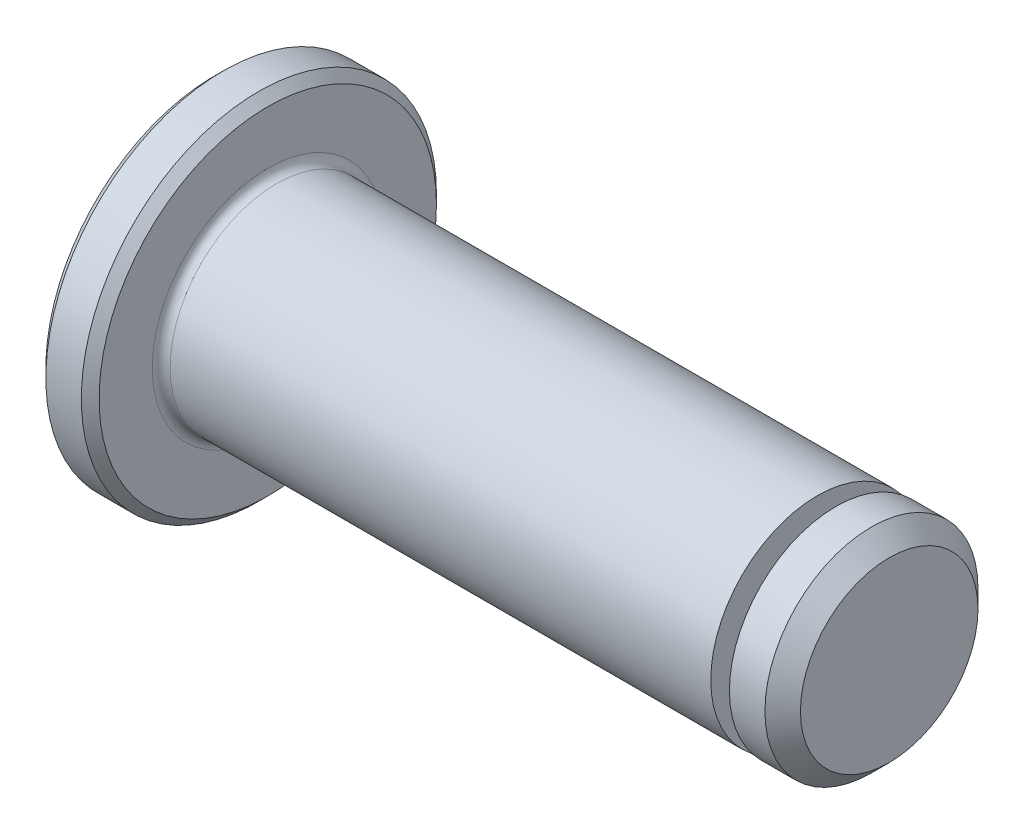
from build123d import *

# Parameters (mm, degrees)
SCHIZZO1_R                   = 10
ESTRUSIONE_ESTRUSIONE1_DEPTH = 3
SCHIZZO2_R                   = 6
ESTRUSIONE_ESTRUSIONE2_DEPTH = 35
SCHIZZO3_W                   = 1.05
SCHIZZO3_H                   = 2
SMUSSO1_SIZE                 = 1
SMUSSO2_SIZE                 = 0.5
RACCORDO1_R                  = 0.5


with BuildPart() as part:
    # Schizzo1 → Estrusione-Estrusione1 (new body)
    with BuildSketch(Plane(origin=(0, 0, 0), x_dir=(0, 0, -1), z_dir=(1, 0, 0))):
        Circle(SCHIZZO1_R)
    extrude(amount=ESTRUSIONE_ESTRUSIONE1_DEPTH)

    # Schizzo2 → Estrusione-Estrusione2 (add)
    with BuildSketch(Plane(origin=(3, 0, 0), x_dir=(0, 0, -1), z_dir=(1, 0, 0))):
        Circle(SCHIZZO2_R)
    extrude(amount=ESTRUSIONE_ESTRUSIONE2_DEPTH)

    # Schizzo3 → Taglia-Rivoluzione1 (revolve, cut)
    with BuildSketch(Plane.XY, mode=Mode.PRIVATE) as taglia_rivoluzione1_sk:
        with Locations((34.475, 5)):
            Rectangle(SCHIZZO3_W, SCHIZZO3_H)
    revolve(taglia_rivoluzione1_sk.sketch.rotate(Axis((0, 0, 0), (1, 0, 0)), 90), axis=Axis((0, 0, 0), (1, 0, 0)), mode=Mode.SUBTRACT)

    # Smusso1
    smusso1_edges = [part.edges().sort_by_distance(p)[0] for p in [
        (38, 0, 6),
    ]]
    chamfer(smusso1_edges, length=SMUSSO1_SIZE)

    # Smusso2
    smusso2_edges = [part.edges().sort_by_distance(p)[0] for p in [
        (0, 0, 10),
        (3, 0, 10),
    ]]
    chamfer(smusso2_edges, length=SMUSSO2_SIZE)

    # Raccordo1
    raccordo1_edges = [part.edges().sort_by_distance(p)[0] for p in [
        (3, 0, 6),
    ]]
    fillet(raccordo1_edges, radius=RACCORDO1_R)


solid = part.part
